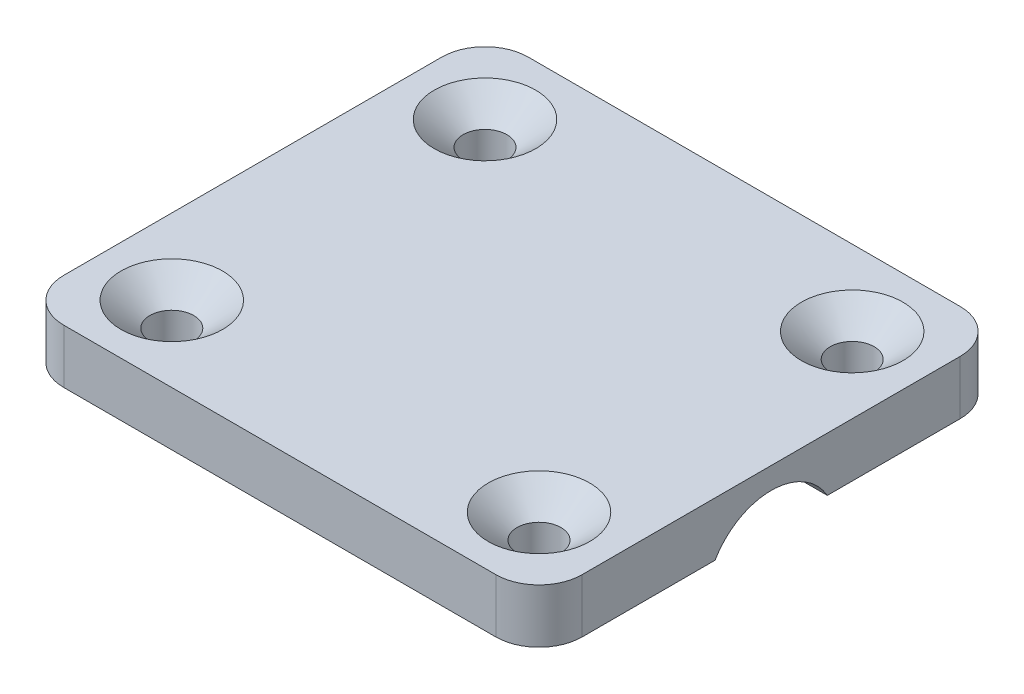
from build123d import *

# Parameters (mm, degrees)
SKETCH1_W                                   = 48
SKETCH1_H                                   = 43
BOSS_EXTRUDE1_DEPTH                         = 5
FILLET1_R                                   = 4
CSK_FOR_1_4_FLAT_HEAD_MACHINE_SCREW_2_COUNT = 2
CSK_FOR_1_4_FLAT_HEAD_MACHINE_SCREW_2_PITCH = 29
CUT_EXTRUDE2_DEPTH                          = 55


with BuildPart() as part:
    # Sketch1 → Boss-Extrude1 (new body)
    with BuildSketch(Plane(origin=(0, 0, 0), x_dir=(1, 0, 0), z_dir=(0, 1, 0))):
        Rectangle(SKETCH1_W, SKETCH1_H)
    extrude(amount=BOSS_EXTRUDE1_DEPTH)

    # Fillet1
    fillet1_edges = [part.edges().sort_by_distance(p)[0] for p in [
        (24, 2.5, 21.5),
        (-24, 2.5, 21.5),
        (-24, 2.5, -21.5),
        (24, 2.5, -21.5),
    ]]
    fillet(fillet1_edges, radius=FILLET1_R)

    # Sketch3 → CSK for 1/4 Flat Head Machine Screw (100)1 (revolve, cut)
    with BuildSketch(Plane(origin=(17, 5, 14.5), x_dir=(0, 0, 1), z_dir=(1, 0, 0))):
        Polygon((0, 0), (0, 30), (2.032, 28.779051222), (2.032, 2.237878716), (4.699, 0), align=None)
    csk_for_1_4_flat_head_machine_screw_100 = revolve(axis=Axis((17, 11.35, 14.5), (0, -1, 0)), mode=Mode.SUBTRACT)

    # CSK for 1_4 Flat Head Machine Screw  2: CSK for 1/4 Flat Head Machine Screw (100)1 ×2
    with Locations(*[(0, 0, -i * CSK_FOR_1_4_FLAT_HEAD_MACHINE_SCREW_2_PITCH) for i in range(1, CSK_FOR_1_4_FLAT_HEAD_MACHINE_SCREW_2_COUNT)]):
        add(csk_for_1_4_flat_head_machine_screw_100, mode=Mode.SUBTRACT)

    # Mirror1: CSK for 1/4 Flat Head Machine Screw (100)1 across plane
    add(csk_for_1_4_flat_head_machine_screw_100.mirror(Plane(origin=(0, 0, 0), x_dir=(0, 0, 1), z_dir=(1, 0, 0))), mode=Mode.SUBTRACT)

    # Mirror1 copy 1 sketch → Mirror1 copy 1 (revolve, cut)
    with BuildSketch(Plane(origin=(-17, 5, -14.5), x_dir=(0, 0, 1), z_dir=(-1, 0, 0))):
        Polygon((0, 0), (0, -30), (2.032, -28.779051222), (2.032, -2.237878716), (4.699, 0), align=None)
    revolve(axis=Axis((-17, 11.35, -14.5), (0, 1, 0)), mode=Mode.SUBTRACT)

    # Sketch6 → Cut-Extrude2 (cut)
    with BuildSketch(Plane(origin=(24, 0, 0), x_dir=(0, 0, -1), z_dir=(1, 0, 0))):
        with BuildLine():
            Line((-5.196152423, 0), (5.196152423, 0))
            ThreePointArc((5.196152423, 0), (0, 3), (-5.196152423, 0))
        make_face()
    extrude(amount=-CUT_EXTRUDE2_DEPTH, mode=Mode.SUBTRACT)


solid = part.part
